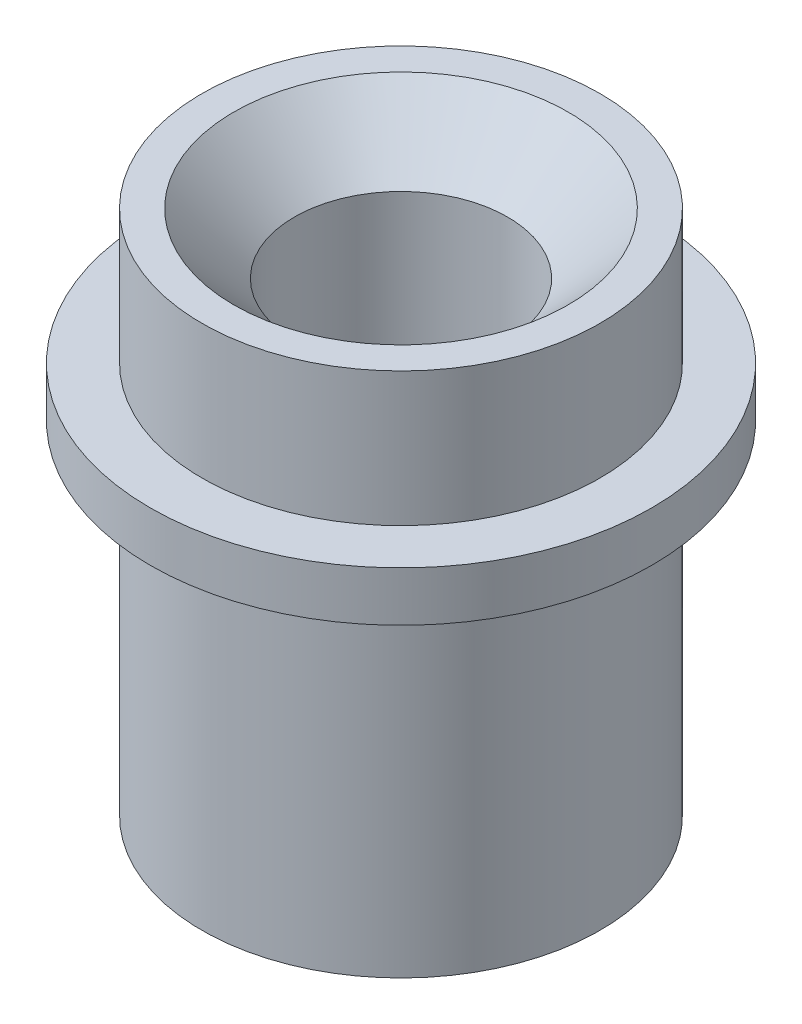
from build123d import *

# Parameters (mm, degrees)
SKETCH_2_R          = 1.67
CUT_EXTRUDE_1_DEPTH = 10.939185077


with BuildPart() as part:
    # 草图1 → 旋转1 (revolve)
    with BuildSketch(Plane.XY, mode=Mode.PRIVATE) as revolve_1_sk:
        Polygon((0, 0), (3.12, 0), (3.12, 5.36), (3.93, 5.36), (3.93, 6.14), (3.12, 6.14), (3.12, 8.24), (0, 8.24), align=None)
    revolve(revolve_1_sk.sketch.rotate(Axis((0, 0, 0), (0, 1, 0)), 90), axis=Axis((0, 0, 0), (0, 1, 0)))

    # 草图2 → 切除-拉伸1 (cut, through all)
    with BuildSketch(Plane.XZ):
        with Locations(Location((0, 0, 0), (0, 0, 270))):
            Circle(SKETCH_2_R)
    extrude(amount=-CUT_EXTRUDE_1_DEPTH, mode=Mode.SUBTRACT)

    # 草图4 → 切除-旋转1 (revolve, cut)
    with BuildSketch(Plane.XY, mode=Mode.PRIVATE) as cut_revolve_1_sk:
        Polygon((2.62, 0), (1.67, 0.95), (0, 0.95), (0, 0), align=None)
        Polygon((2.62, 8.24), (1.67, 7.29), (0, 7.29), (0, 8.24), align=None)
    revolve(cut_revolve_1_sk.sketch.rotate(Axis((0, 0, 0), (0, -1, 0)), 90), axis=Axis((0, 0, 0), (0, -1, 0)), mode=Mode.SUBTRACT)


solid = part.part
